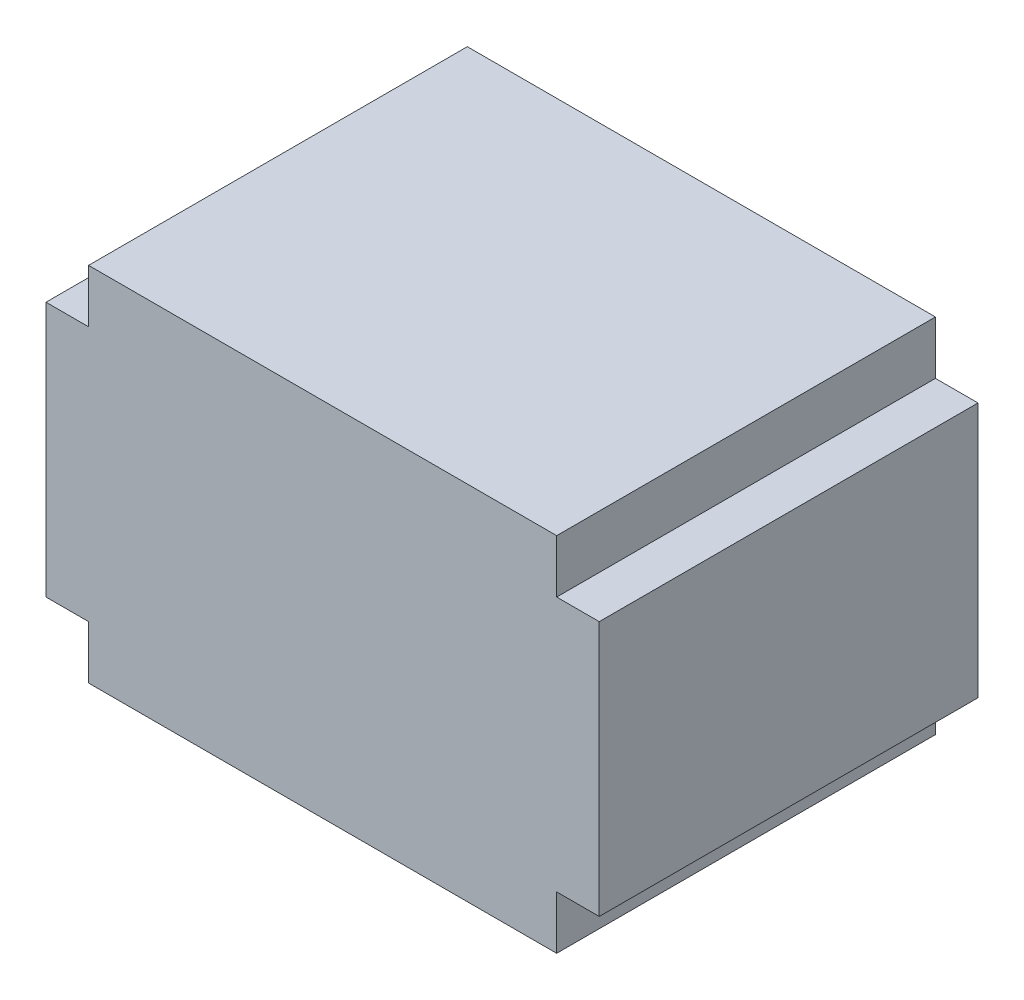
from build123d import *

# Parameters (mm, degrees)
COMPONENT_OUTLINE_DEPTH = 1.78


with BuildPart() as part:
    # 草图1 → Component_Outline (new body)
    with BuildSketch(Plane.XY):
        Polygon((-1.1, -0.85), (-1.1, -0.6), (-1.3, -0.6), (-1.3, 0.6), (-1.1, 0.6), (-1.1, 0.85), (1.1, 0.85), (1.1, 0.6), (1.3, 0.6), (1.3, -0.6), (1.1, -0.6), (1.1, -0.85), align=None)
    extrude(amount=COMPONENT_OUTLINE_DEPTH)


solid = part.part
